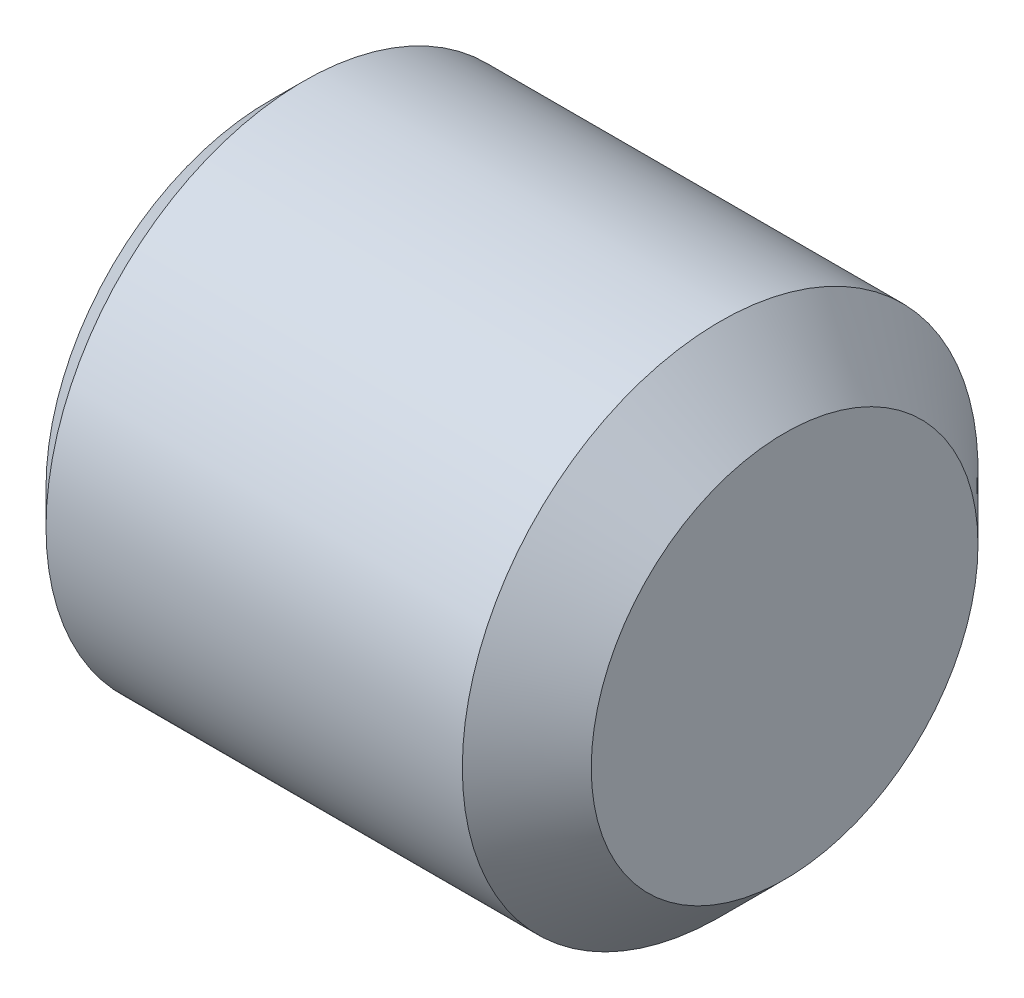
from build123d import *

# Parameters (mm, degrees)
HEXAGONSOCKET_DEPTH = 8


with BuildPart() as part:
    # Sketch1 → Base (revolve)
    with BuildSketch(Plane.XY, mode=Mode.PRIVATE) as base_sk:
        Polygon((0, 0), (20, 0), (20, 7.5), (17.5, 10), (1.353, 10), (0, 8.647), align=None)
    revolve(base_sk.sketch.rotate(Axis((-10.745014543, 0, 0), (1, 0, 0)), 90), axis=Axis((-10.745014543, 0, 0), (1, 0, 0)))

    # Sketch2 → HexagonSocket (cut)
    with BuildSketch(Plane(origin=(0, -0.021932325, 0.010138848), x_dir=(0, 0, 1), z_dir=(-1, 0, 0))):
        Polygon((5.763363844, 0.021932325), (2.876612498, 5.021932325), (-2.896890194, 5.021932325), (-5.78364154, 0.021932325), (-2.896890194, -4.978067675), (2.876612498, -4.978067675), align=None)
    extrude(amount=-HEXAGONSOCKET_DEPTH, mode=Mode.SUBTRACT)

    # Sketch3 → Cut-Revolve1 (revolve, cut)
    with BuildSketch(Plane.XY, mode=Mode.PRIVATE) as cut_revolve1_sk:
        Polygon((8, 5), (10.886751346, 0), (8, 0), align=None)
    revolve(cut_revolve1_sk.sketch.rotate(Axis((-3.144113667, 0, 0), (1, 0, 0)), 90), axis=Axis((-3.144113667, 0, 0), (1, 0, 0)), mode=Mode.SUBTRACT)


solid = part.part
